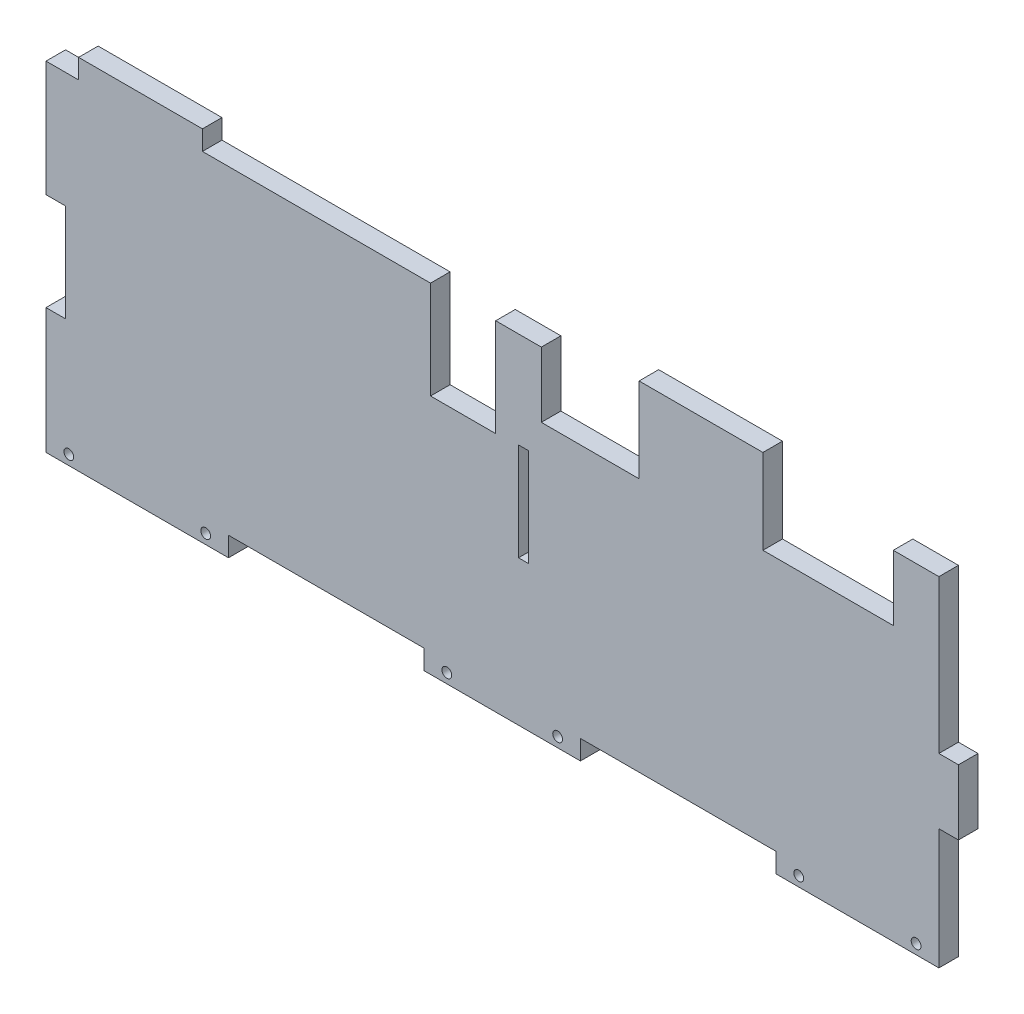
from build123d import *

# Parameters (mm, degrees)
ESQUISSE2_W             = 330
ESQUISSE2_H             = 110
BOSS_EXTRU_1_DEPTH      = 6
ESQUISSE3_W             = 6
ESQUISSE3_H             = 37
ESQUISSE3_W_2           = 60
ESQUISSE3_H_2           = 6
ESQUISSE3_H_3           = 30
ESQUISSE3_H_4           = 39
ESQUISSE3_W_3           = 3
ENL_V_MAT_EXTRU_1_DEPTH = 348.902285132
ESQUISSE4_W             = 56.799161249
ESQUISSE4_H             = 104
ENL_V_MAT_EXTRU_2_DEPTH = 348.902285132
ESQUISSE5_R             = 1.5
ENL_V_MAT_EXTRU_3_DEPTH = 301.892007205
ESQUISSE6_R             = 2.995
ENL_V_MAT_EXTRU_5_DEPTH = 3


with BuildPart() as part:
    # Esquisse2 → Boss.-Extru.1 (new body)
    with BuildSketch(Plane.XY):
        with Locations((-165, 55)):
            Rectangle(ESQUISSE2_W, ESQUISSE2_H)
    extrude(amount=BOSS_EXTRU_1_DEPTH)

    # Esquisse3 → Enlèv. mat.-Extru.1 (cut, through all)
    with BuildSketch(Plane.XY.offset(6)):
        Polygon((-60, 110), (0, 110), (0, 57), (-6, 57), (-6, 104), (-20, 104), (-20, 84), (-60, 84), align=None)
        with Locations((-3, 18.5)):
            Rectangle(ESQUISSE3_W, ESQUISSE3_H)
        Polygon((-330, 110), (-270, 110), (-270, 104), (-324, 104), (-324, 59), (-330, 59), align=None)
        with Locations((-86, 3)):
            Rectangle(ESQUISSE3_W_2, ESQUISSE3_H_2)
        with Locations((-194, 3)):
            Rectangle(ESQUISSE3_W_2, ESQUISSE3_H_2)
        with Locations((-277, 53.5)):
            Rectangle(ESQUISSE3_W, ESQUISSE3_H_3)
        with Locations((-327, 19.5)):
            Rectangle(ESQUISSE3_W, ESQUISSE3_H_4)
        Polygon((-98, 110), (-98, 84), (-128, 84), (-128, 104), (-142, 104), (-142, 74), (-162, 74), (-162, 104), (-232, 104), (-232, 110), align=None)
        with Locations((-133.5, 59.5)):
            Rectangle(ESQUISSE3_W_3, ESQUISSE3_H_3)
    extrude(amount=-ENL_V_MAT_EXTRU_1_DEPTH, mode=Mode.SUBTRACT)

    # Esquisse4 → Enlèv. mat.-Extru.2 (cut, through all)
    with BuildSketch(Plane.XY.offset(6)):
        with Locations((-308.399580625, 52)):
            Rectangle(ESQUISSE4_W, ESQUISSE4_H)
    extrude(amount=-ENL_V_MAT_EXTRU_2_DEPTH, mode=Mode.SUBTRACT)

    # Esquisse5 → Enlèv. mat.-Extru.3 (cut, through all)
    with BuildSketch(Plane(origin=(0, 0, 0), x_dir=(-1, 0, 0), z_dir=(0, 0, -1))):
        with Locations((13, 3)):
            Circle(ESQUISSE5_R)
        with Locations((49, 3)):
            Circle(ESQUISSE5_R)
        with Locations((123, 3)):
            Circle(ESQUISSE5_R)
        with Locations((157, 3)):
            Circle(ESQUISSE5_R)
        with Locations((231, 3)):
            Circle(ESQUISSE5_R)
        with Locations((273, 3)):
            Circle(ESQUISSE5_R)
    extrude(amount=-ENL_V_MAT_EXTRU_3_DEPTH, mode=Mode.SUBTRACT)

    # Esquisse6 → Enlèv. mat.-Extru.5 (cut)
    with BuildSketch(Plane(origin=(0, 0, 0), x_dir=(-1, 0, 0), z_dir=(0, 0, -1))):
        with Locations((13, 3)):
            Circle(ESQUISSE6_R)
        with Locations((49, 3)):
            Circle(ESQUISSE6_R)
        with Locations((123, 3)):
            Circle(ESQUISSE6_R)
        with Locations((157, 3)):
            Circle(ESQUISSE6_R)
        with Locations((273, 3)):
            Circle(ESQUISSE6_R)
        with Locations((231, 3)):
            Circle(ESQUISSE6_R)
    extrude(amount=-ENL_V_MAT_EXTRU_5_DEPTH, mode=Mode.SUBTRACT)


solid = part.part
